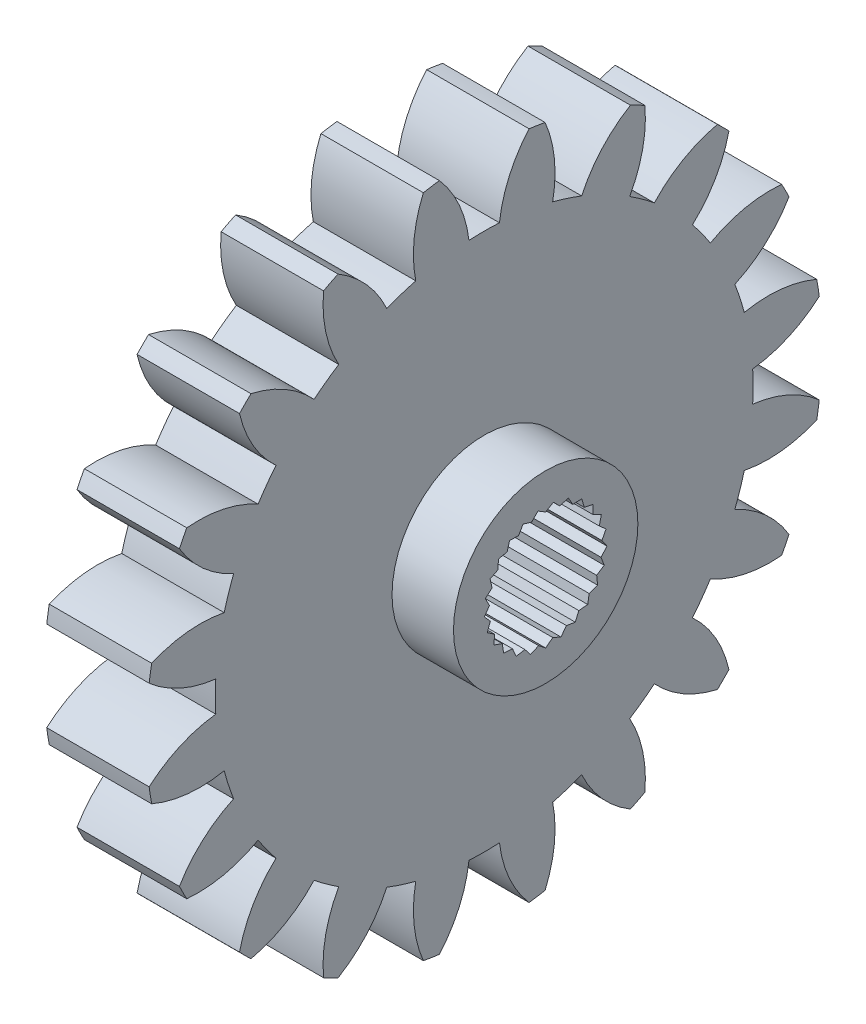
from build123d import *

# Parameters (mm, degrees)
BASPROSKE_W         = 5
BASPROSKE_H         = 16.5
TOOTHCUT_DEPTH      = 24.864199128
TEETHCUTS_COUNT     = 20
TEETHCUTS_ANGLE     = 342
BORSKE_R            = 2.5
BORE_DEPTH          = 50.0000508
BOSS_EXTRUDE1_START = 3
SKETCH1_R           = 4.5
SKETCH1_R_2         = 2.5
BOSS_EXTRUDE1_DEPTH = 3
SKETCH2_R           = 2.75
SKETCH2_R_2         = 2.5
CUT_EXTRUDE1_DEPTH  = 25.472631648
CIRPATTERN1_COUNT   = 25


with BuildPart() as part:
    # BasProSke → Base-Revolve (revolve)
    with BuildSketch(Plane(origin=(0, 0, 0), x_dir=(1, 0, 0), z_dir=(0, 1, 0)), mode=Mode.PRIVATE) as base_revolve_sk:
        with Locations((2.5, 8.25)):
            Rectangle(BASPROSKE_W, BASPROSKE_H)
    revolve(base_revolve_sk.sketch.rotate(Axis((-10, 0, 0), (1, 0, 0)), 180), axis=Axis((-10, 0, 0), (1, 0, 0)))

    # TooCutSke → ToothCut (cut, through all)
    with BuildSketch(Plane(origin=(0, 0, 0), x_dir=(0, 0, -1), z_dir=(1, 0, 0))):
        with BuildLine():
            ThreePointArc((0.74381438, 13.102904875), (0, 13.124), (-0.74381438, 13.102904875))
            ThreePointArc((-0.74381438, 13.102904875), (-1.226473103, 14.852072512), (-2.209965745, 16.376962373))
            ThreePointArc((-2.209965745, 16.376962373), (0, 16.5254), (2.209965745, 16.376962373))
            ThreePointArc((2.209965745, 16.376962373), (1.226473103, 14.852072512), (0.74381438, 13.102904875))
        make_face()
    toothcut = extrude(amount=TOOTHCUT_DEPTH, mode=Mode.SUBTRACT)

    # TeethCuts: ToothCut ×20 about axis
    teethcuts_axis = Axis((-10, 0, 0), (1, 0, 0))
    for i in range(1, TEETHCUTS_COUNT):
        add(toothcut.rotate(teethcuts_axis, i * TEETHCUTS_ANGLE / (TEETHCUTS_COUNT - 1)), mode=Mode.SUBTRACT)

    # BorSke → Bore (cut, symmetric)
    with BuildSketch(Plane(origin=(0, 0, 0), x_dir=(0, 0, -1), z_dir=(1, 0, 0))):
        with Locations(Location((0, 0, 0), (0, 0, 180))):
            Circle(BORSKE_R)
    extrude(amount=BORE_DEPTH, both=True, mode=Mode.SUBTRACT)

    # Sketch1 → Boss-Extrude1 (add)
    with BuildSketch(Plane(origin=(5, 0, 0), x_dir=(0, 0, -1), z_dir=(1, 0, 0)).offset(BOSS_EXTRUDE1_START)):
        with Locations(Location((0, 0, 0), (0, 0, 180))):
            Circle(SKETCH1_R)
        Circle(SKETCH1_R_2, mode=Mode.SUBTRACT)
    extrude(amount=-BOSS_EXTRUDE1_DEPTH)

    # Sketch2 → Cut-Extrude1 (cut, through all)
    # profile 1 of 2: a face of its own
    with BuildSketch(Plane(origin=(8, 0, 0), x_dir=(0, 0, -1), z_dir=(1, 0, 0))):
        with BuildLine():
            ThreePointArc((0.344666392, -2.728315429), (0, -2.75), (-0.344666392, -2.728315429))
            Line((-0.344666392, -2.728315429), (0, -3))
            Line((0, -3), (0.344666392, -2.728315429))
        make_face()
    # profile 2 of 2: a face of its own
    with BuildSketch(Plane(origin=(8, 0, 0), x_dir=(0, 0, -1), z_dir=(1, 0, 0))):
        Circle(SKETCH2_R)
        Circle(SKETCH2_R_2, mode=Mode.SUBTRACT)
    cut_extrude1 = extrude(amount=-CUT_EXTRUDE1_DEPTH, mode=Mode.SUBTRACT)

    # CirPattern1: Cut-Extrude1 ×25 about axis
    cirpattern1_axis = Axis((0, 0, 0), (1, 0, 0))
    for i in range(1, CIRPATTERN1_COUNT):
        add(cut_extrude1.rotate(cirpattern1_axis, i * 360 / CIRPATTERN1_COUNT), mode=Mode.SUBTRACT)


solid = part.part
